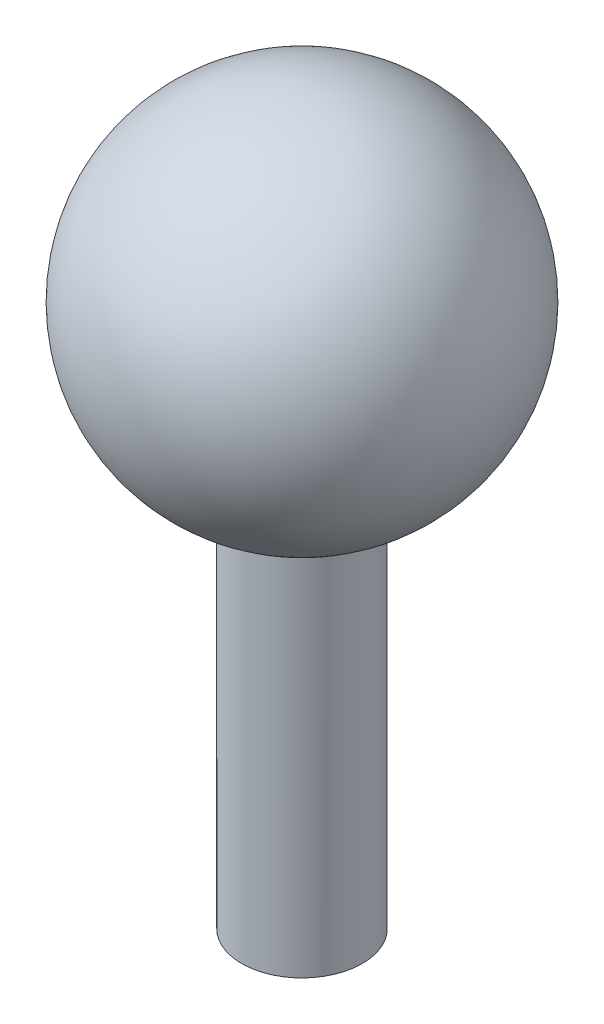
from build123d import *


with BuildPart() as part:
    # Sketch1 → Revolve1 (revolve)
    with BuildSketch(Plane.XY, mode=Mode.PRIVATE) as revolve1_sk:
        with BuildLine():
            Line((0, 0), (-5, 0))
            Line((-5, 0), (-5, 30.857864376))
            ThreePointArc((-5, 30.857864376), (-14.783978395, 47.536529681), (0, 60))
            Line((0, 60), (0, 0))
        make_face()
    revolve(revolve1_sk.sketch.rotate(Axis((0, 0, 0), (0, 1, 0)), 180), axis=Axis((0, 0, 0), (0, 1, 0)))


solid = part.part
